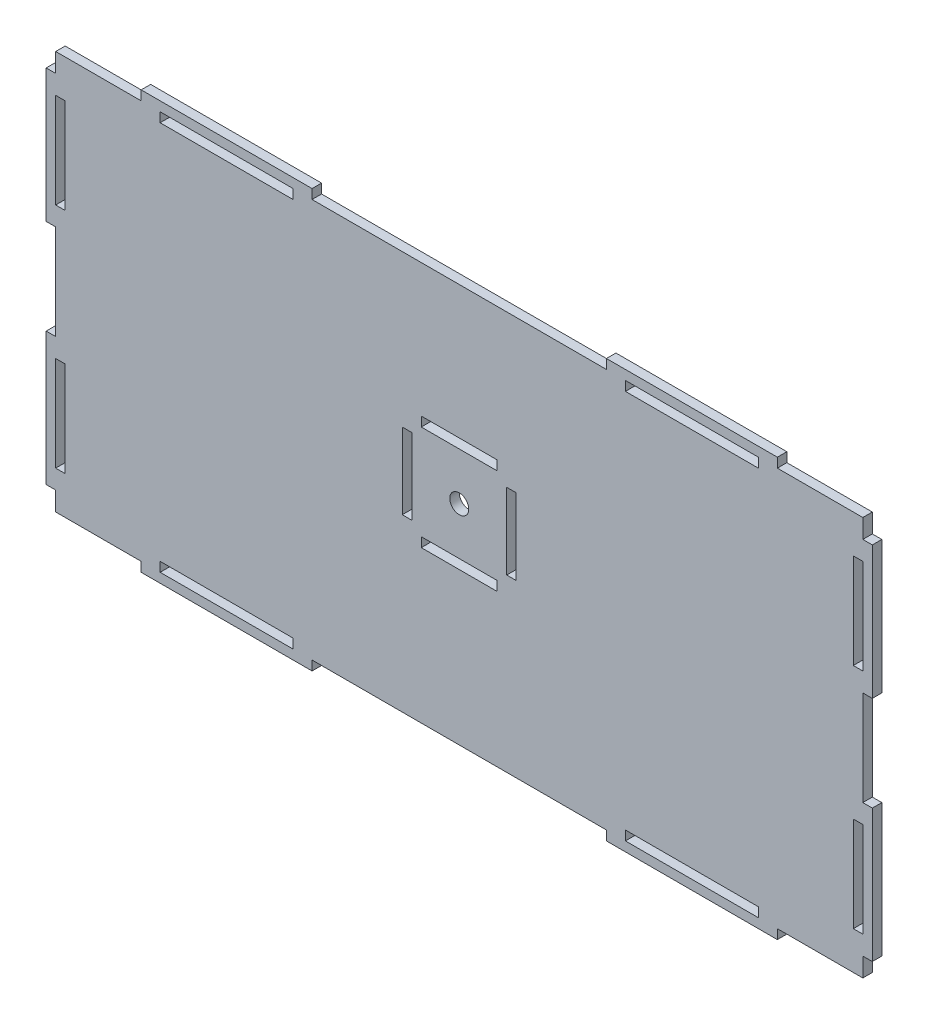
from build123d import *

# Parameters (mm, degrees)
SKETCH1_W           = 425
SKETCH1_H           = 210
SKETCH1_R           = 5
BOSS_EXTRUDE1_DEPTH = 5
SKETCH2_W           = 70
SKETCH2_H           = 5
SKETCH2_W_2         = 5
SKETCH2_H_2         = 50
CUT_EXTRUDE1_DEPTH  = 5
SKETCH3_W           = 90
SKETCH3_H           = 5
BOSS_EXTRUDE2_DEPTH = 5
SKETCH4_W           = 5
SKETCH4_H           = 70
BOSS_EXTRUDE3_DEPTH = 5
SKETCH5_W           = 5
SKETCH5_H           = 40
SKETCH5_W_2         = 40
SKETCH5_H_2         = 5
CUT_EXTRUDE2_DEPTH  = 5


with BuildPart() as part:
    # Sketch1 → Boss-Extrude1 (new body)
    with BuildSketch(Plane.XY):
        with Locations((-212.5, 105)):
            Rectangle(SKETCH1_W, SKETCH1_H)
        with Locations((-212.5, 110)):
            Circle(SKETCH1_R, mode=Mode.SUBTRACT)
    extrude(amount=BOSS_EXTRUDE1_DEPTH)

    # Sketch2 → Cut-Extrude1 (cut)
    with BuildSketch(Plane(origin=(0, 0, 0), x_dir=(-1, 0, 0), z_dir=(0, 0, -1))):
        with Locations((90, 2.5)):
            Rectangle(SKETCH2_W, SKETCH2_H)
        with Locations((2.5, 45)):
            Rectangle(SKETCH2_W_2, SKETCH2_H_2)
        with Locations((2.5, 165)):
            Rectangle(SKETCH2_W_2, SKETCH2_H_2)
        with Locations((90, 207.5)):
            Rectangle(SKETCH2_W, SKETCH2_H)
        with Locations((335, 207.5)):
            Rectangle(SKETCH2_W, SKETCH2_H)
        with Locations((422.5, 165)):
            Rectangle(SKETCH2_W_2, SKETCH2_H_2)
        with Locations((422.5, 45)):
            Rectangle(SKETCH2_W_2, SKETCH2_H_2)
        with Locations((335, 2.5)):
            Rectangle(SKETCH2_W, SKETCH2_H)
    extrude(amount=-CUT_EXTRUDE1_DEPTH, mode=Mode.SUBTRACT)

    # Sketch3 → Boss-Extrude2 (add)
    with BuildSketch(Plane.XY.offset(5)):
        with Locations((-335, 212.5)):
            Rectangle(SKETCH3_W, SKETCH3_H)
        with Locations((-90, 212.5)):
            Rectangle(SKETCH3_W, SKETCH3_H)
        with Locations((-335, -2.5)):
            Rectangle(SKETCH3_W, SKETCH3_H)
        with Locations((-90, -2.5)):
            Rectangle(SKETCH3_W, SKETCH3_H)
    extrude(amount=-BOSS_EXTRUDE2_DEPTH)

    # Sketch4 → Boss-Extrude3 (add)
    with BuildSketch(Plane.XY.offset(5)):
        with Locations((-427.5, 165)):
            Rectangle(SKETCH4_W, SKETCH4_H)
        with Locations((-427.5, 45)):
            Rectangle(SKETCH4_W, SKETCH4_H)
        with Locations((2.5, 45)):
            Rectangle(SKETCH4_W, SKETCH4_H)
        with Locations((2.5, 165)):
            Rectangle(SKETCH4_W, SKETCH4_H)
    extrude(amount=-BOSS_EXTRUDE3_DEPTH)

    # Sketch5 → Cut-Extrude2 (cut)
    with BuildSketch(Plane.XY.offset(5)):
        with Locations((-240, 110)):
            Rectangle(SKETCH5_W, SKETCH5_H)
        with Locations((-212.5, 82.5)):
            Rectangle(SKETCH5_W_2, SKETCH5_H_2)
        with Locations((-212.5, 137.5)):
            Rectangle(SKETCH5_W_2, SKETCH5_H_2)
        with Locations((-185, 110)):
            Rectangle(SKETCH5_W, SKETCH5_H)
    extrude(amount=-CUT_EXTRUDE2_DEPTH, mode=Mode.SUBTRACT)


solid = part.part
